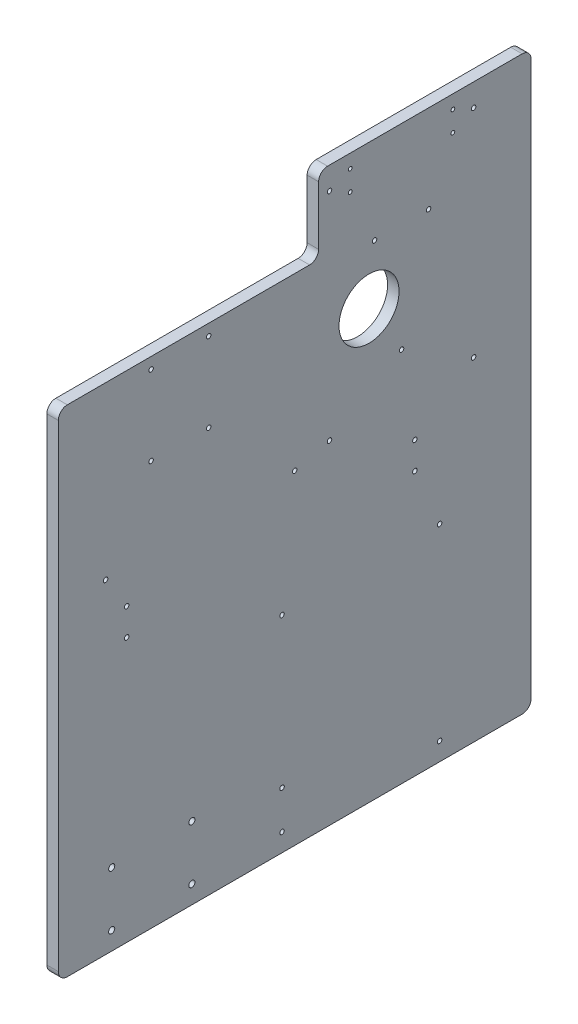
from build123d import *

# Parameters (mm, degrees)
SKETCH1_R             = 33.3375
BOSS_EXTRUDE1_DEPTH   = 12.7
FILLET1_R             = 10
M5_TAPPED_HOLE1_D     = 4.2
M5_TAPPED_HOLE1_DEPTH = 14
M5_TAPPED_HOLE1_TIP   = 1.2618073
M6_TAPPED_HOLE1_D     = 5
M6_TAPPED_HOLE2_D     = 5
M6_TAPPED_HOLE3_D     = 5
M6_TAPPED_HOLE4_D     = 5
M6_TAPPED_HOLE5_D     = 5
M8_TAPPED_HOLE1_D     = 6.8
M6_TAPPED_HOLE6_D     = 5


with BuildPart() as part:
    # Sketch1 → Boss-Extrude1 (new body)
    with BuildSketch(Plane(origin=(0, 0, 0), x_dir=(0, 0, -1), z_dir=(1, 0, 0))):
        Polygon((26.5, 317.5), (262.5, 317.5), (262.5, -317.5), (-262.5, -317.5), (-262.5, 232.5), (26.5, 232.5), align=None)
        with Locations((82.5, 157.5)):
            Circle(SKETCH1_R, mode=Mode.SUBTRACT)
    extrude(amount=BOSS_EXTRUDE1_DEPTH)

    # Fillet1
    fillet1_edges = [part.edges().sort_by_distance(p)[0] for p in [
        (6.35, -317.5, -262.5),
        (6.35, -317.5, 262.5),
        (6.35, 232.5, 262.5),
        (6.35, 232.5, -26.5),
        (6.35, 317.5, -26.5),
        (6.35, 317.5, -262.5),
    ]]
    fillet(fillet1_edges, radius=FILLET1_R)

    # M5 Tapped Hole1
    with Locations(Plane(origin=(12.7, 0, 0), x_dir=(0, 0, -1), z_dir=(1, 0, 0))):
        with Locations((175.625, 302.5), (175.625, 280), (61.625, 280), (61.625, 302.5)):
            Hole(M5_TAPPED_HOLE1_D / 2, depth=M5_TAPPED_HOLE1_DEPTH)
            with Locations((0, 0, -(M5_TAPPED_HOLE1_DEPTH + M5_TAPPED_HOLE1_TIP / 2))):  # 118° drill point
                Cone(0, M5_TAPPED_HOLE1_D / 2, M5_TAPPED_HOLE1_TIP, mode=Mode.SUBTRACT)

    # M6 Tapped Hole1 (through all)
    with Locations(Plane(origin=(12.7, 0, 0), x_dir=(0, 0, -1), z_dir=(1, 0, 0))):
        with Locations((-186.587628, 5.81216), (-186.587628, -24.18784), (133.412372, 5.81216), (133.412372, -24.18784)):
            Hole(M6_TAPPED_HOLE1_D / 2)

    # M6 Tapped Hole2 (through all)
    with Locations(Plane(origin=(12.7, 0, 0), x_dir=(0, 0, -1), z_dir=(1, 0, 0))):
        with Locations((-210.013308, 42.88784), (-0.013308, 42.88784)):
            Hole(M6_TAPPED_HOLE2_D / 2)

    # M6 Tapped Hole3 (through all)
    with Locations(Plane(origin=(12.7, 0, 0), x_dir=(0, 0, -1), z_dir=(1, 0, 0))):
        with Locations((88.625, 220), (148.625, 220), (118.625, 100)):
            Hole(M6_TAPPED_HOLE3_D / 2)

    # M6 Tapped Hole4 (through all)
    with Locations(Plane(origin=(12.7, 0, 0), x_dir=(0, 0, -1), z_dir=(1, 0, 0))):
        with Locations((198.625, 292.5), (38.625, 292.5), (38.625, 52.5), (198.625, 52.5)):
            Hole(M6_TAPPED_HOLE4_D / 2)

    # M6 Tapped Hole5 (through all)
    with Locations(Plane(origin=(12.7, 0, 0), x_dir=(0, 0, -1), z_dir=(1, 0, 0))):
        with Locations((-14.1, -254.9), (-14.1, -88.9), (160.9, -297.4), (160.9, -88.9), (-14.1, -297.4)):
            Hole(M6_TAPPED_HOLE5_D / 2)

    # M8 Tapped Hole1 (through all)
    with Locations(Plane(origin=(12.7, 0, 0), x_dir=(0, 0, -1), z_dir=(1, 0, 0))):
        with Locations((-203.2135, -237.075), (-114.1865, -237.075), (-114.1865, -297.4), (-203.2135, -297.4)):
            Hole(M8_TAPPED_HOLE1_D / 2)

    # M6 Tapped Hole6 (through all)
    with Locations(Plane(origin=(12.7, 0, 0), x_dir=(0, 0, -1), z_dir=(1, 0, 0))):
        with Locations((-159.5, 220), (-95.5, 220), (-95.5, 132), (-159.5, 132)):
            Hole(M6_TAPPED_HOLE6_D / 2)


solid = part.part
